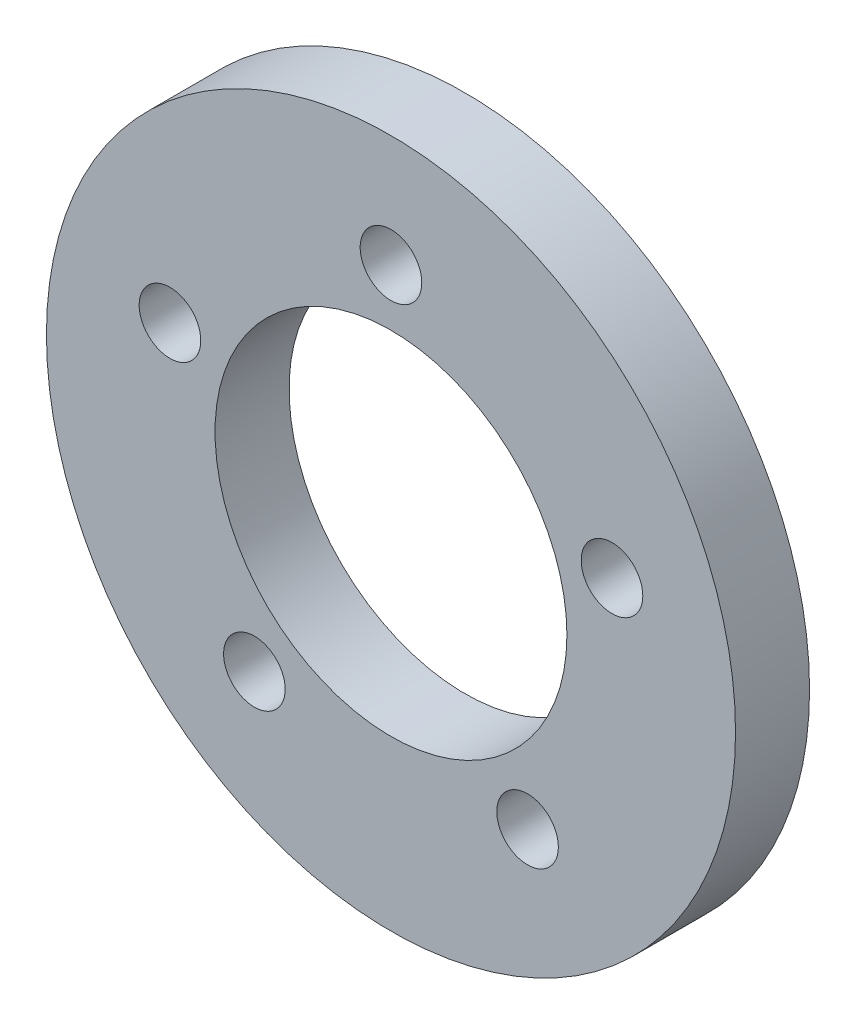
from build123d import *

# Parameters (mm, degrees)
SKETCH1_R           = 23.5
SKETCH1_R_2         = 2.1
SKETCH1_R_3         = 12
BOSS_EXTRUDE1_DEPTH = 5.05


with BuildPart() as part:
    # Sketch1 → Boss-Extrude1 (new body)
    with BuildSketch(Plane.XY):
        Circle(SKETCH1_R)
        with Locations((0, 15.85)):
            Circle(SKETCH1_R_2, mode=Mode.SUBTRACT)
        with Locations((15.074245783, 4.897919361)):
            Circle(SKETCH1_R_2, mode=Mode.SUBTRACT)
        with Locations((9.316396249, -12.822919361)):
            Circle(SKETCH1_R_2, mode=Mode.SUBTRACT)
        Circle(SKETCH1_R_3, mode=Mode.SUBTRACT)
        with Locations((-9.316396249, -12.822919361)):
            Circle(SKETCH1_R_2, mode=Mode.SUBTRACT)
        with Locations((-15.074245783, 4.897919361)):
            Circle(SKETCH1_R_2, mode=Mode.SUBTRACT)
    extrude(amount=BOSS_EXTRUDE1_DEPTH)


solid = part.part
